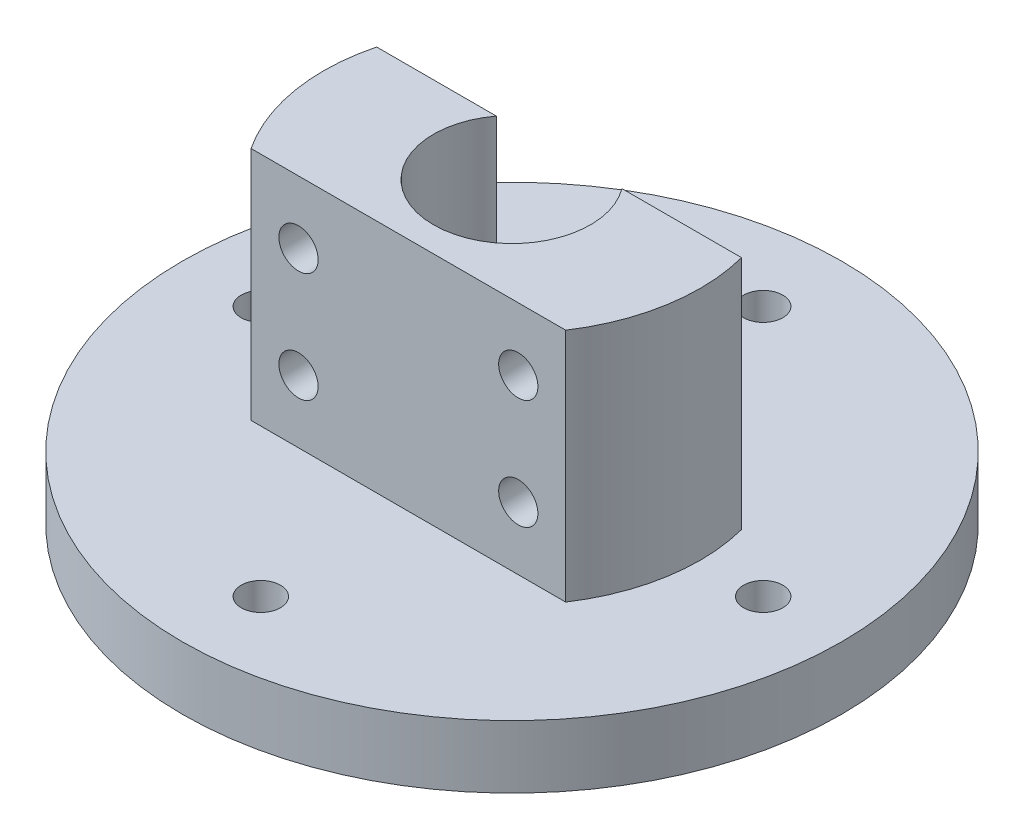
from build123d import *

# Parameters (mm, degrees)
SKETCH_1_R          = 21
EXTRUDE_1_DEPTH     = 4
HOLE_WIZARD_M3_1_D  = 2.5
EXTRUDE_2_DEPTH     = 15
SKETCH_5_R          = 5
CUT_EXTRUDE_1_DEPTH = 36.256205128
HOLE_WIZARD_M3_2_D  = 2.5


with BuildPart() as part:
    # 草图1 → 凸台-拉伸1 (new body)
    with BuildSketch(Plane(origin=(0, 0, 0), x_dir=(1, 0, 0), z_dir=(0, 1, 0))):
        with Locations(Location((0, 0, 0), (0, 0, 270))):
            Circle(SKETCH_1_R)
    extrude(amount=EXTRUDE_1_DEPTH)

    # M3 螺纹孔1 (through all)
    with Locations(Plane(origin=(0, 4, 0), x_dir=(1, 0, 0), z_dir=(0, 1, 0))):
        with Locations((0, 16), (16, 0), (0, -16), (-16, 0)):
            Hole(HOLE_WIZARD_M3_1_D / 2)

    # 草图2 → 凸台-拉伸2 (add)
    with BuildSketch(Plane(origin=(0, 4, 0), x_dir=(1, 0, 0), z_dir=(0, 1, 0))):
        with BuildLine():
            Line((-11.618950039, 3), (11.618950039, 3))
            ThreePointArc((11.618950039, 3), (11.837331556, -1.969157596), (10.021975853, -6.6))
            Line((10.021975853, -6.6), (-10.021975853, -6.6))
            ThreePointArc((-10.021975853, -6.6), (-11.837331556, -1.969157596), (-11.618950039, 3))
        make_face()
    extrude(amount=EXTRUDE_2_DEPTH)

    # 草图5 → 切除-拉伸1 (cut, through all)
    with BuildSketch(Plane(origin=(0, 19, 0), x_dir=(1, 0, 0), z_dir=(0, 1, 0))):
        with Locations(Location((0, 0, 0), (0, 0, 270))):
            Circle(SKETCH_5_R)
    extrude(amount=-CUT_EXTRUDE_1_DEPTH, mode=Mode.SUBTRACT)

    # M3 螺纹孔2 (through all)
    with Locations(Plane(origin=(0, 0, -3), x_dir=(-1, 0, 0), z_dir=(0, 0, -1))):
        with Locations((7, 8), (7, 15), (-7, 8), (-7, 15)):
            Hole(HOLE_WIZARD_M3_2_D / 2)


solid = part.part
